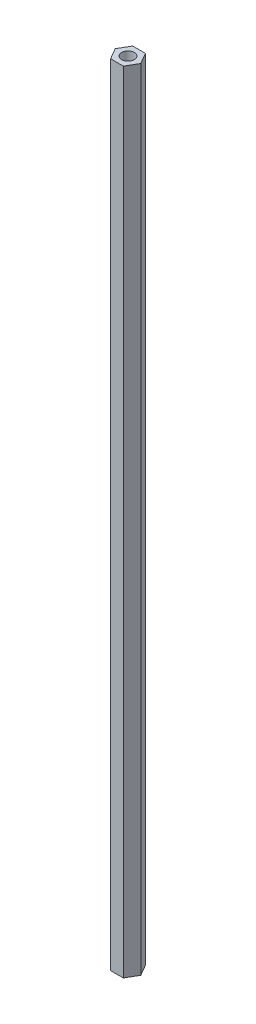
from build123d import *

# Parameters (mm, degrees)
SKETCH1_R           = 2
BOSS_EXTRUDE1_DEPTH = 250


with BuildPart() as part:
    # Sketch1 → Boss-Extrude1 (new body)
    with BuildSketch(Plane(origin=(0, 0, 0), x_dir=(1, 0, 0), z_dir=(0, 1, 0))):
        Polygon((2.020725942, 3.5), (-2.020725942, 3.5), (-4.041451884, 0), (-2.020725942, -3.5), (2.020725942, -3.5), (4.041451884, 0), align=None)
        with Locations(Location((0, 0, 0), (0, 0, 270))):
            Circle(SKETCH1_R, mode=Mode.SUBTRACT)
    extrude(amount=BOSS_EXTRUDE1_DEPTH)


solid = part.part
